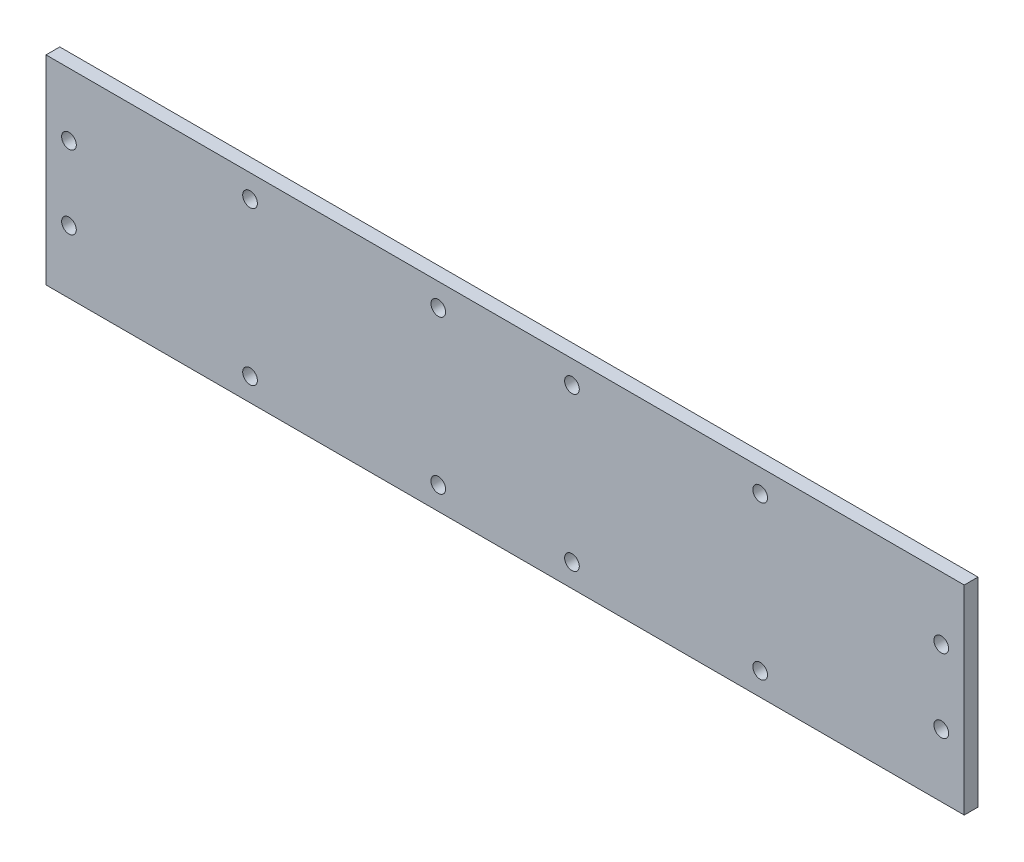
from build123d import *

# Parameters (mm, degrees)
SKETCH_1_W      = 200
SKETCH_1_H      = 43.4
SKETCH_1_R      = 1.6
EXTRUDE_1_DEPTH = 3


with BuildPart() as part:
    # ｽｹｯﾁ1 → ﾎﾞｽ - 押し出し1 (new body)
    with BuildSketch(Plane.XY):
        Rectangle(SKETCH_1_W, SKETCH_1_H)
        with Locations((-14.557299255, 16.7)):
            Circle(SKETCH_1_R, mode=Mode.SUBTRACT)
        with Locations((-55.557299255, 16.7)):
            Circle(SKETCH_1_R, mode=Mode.SUBTRACT)
        with Locations(Location((14.557299255, 16.7, 0), (0, 0, 180))):
            Circle(SKETCH_1_R, mode=Mode.SUBTRACT)
        with Locations(Location((55.557299255, 16.7, 0), (0, 0, 180))):
            Circle(SKETCH_1_R, mode=Mode.SUBTRACT)
        with Locations((55.557299255, -16.7)):
            Circle(SKETCH_1_R, mode=Mode.SUBTRACT)
        with Locations((14.557299255, -16.7)):
            Circle(SKETCH_1_R, mode=Mode.SUBTRACT)
        with Locations(Location((-55.557299255, -16.7, 0), (0, 0, 180))):
            Circle(SKETCH_1_R, mode=Mode.SUBTRACT)
        with Locations(Location((-14.557299255, -16.7, 0), (0, 0, 180))):
            Circle(SKETCH_1_R, mode=Mode.SUBTRACT)
        with Locations((-95, 8)):
            Circle(SKETCH_1_R, mode=Mode.SUBTRACT)
        with Locations(Location((-95, -8, 0), (0, 0, 180))):
            Circle(SKETCH_1_R, mode=Mode.SUBTRACT)
        with Locations((95, -8)):
            Circle(SKETCH_1_R, mode=Mode.SUBTRACT)
        with Locations(Location((95, 8, 0), (0, 0, 180))):
            Circle(SKETCH_1_R, mode=Mode.SUBTRACT)
    extrude(amount=EXTRUDE_1_DEPTH)


solid = part.part
